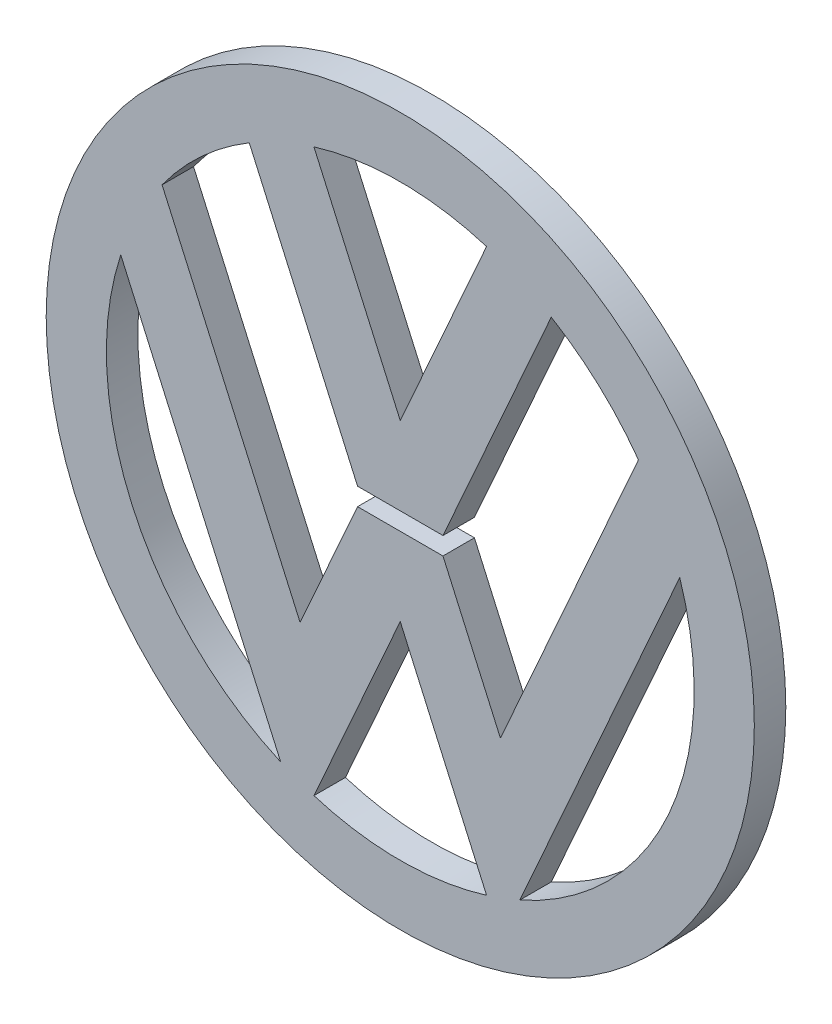
from build123d import *

# Parameters (mm, degrees)
SKETCH1_R           = 45
BOSS_EXTRUDE1_DEPTH = 4


with BuildPart() as part:
    # Sketch1 → Boss-Extrude1 (new body)
    with BuildSketch(Plane.XY):
        Circle(SKETCH1_R)
        with BuildLine():
            Line((-10.969996065, 35.702684582), (0, 11.06367001))
            Line((0, 11.06367001), (10.969996065, 35.702684582))
            ThreePointArc((10.969996065, 35.702684582), (0, 37.35), (-10.969996065, 35.702684582))
        make_face(mode=Mode.SUBTRACT)
        with BuildLine():
            Line((-10.969996065, -35.702684582), (0, -11.06367001))
            Line((0, -11.06367001), (10.969996065, -35.702684582))
            ThreePointArc((10.969996065, -35.702684582), (0, -37.35), (-10.969996065, -35.702684582))
        make_face(mode=Mode.SUBTRACT)
        with BuildLine():
            Line((-35.521960884, 11.54178474), (-15.191613619, -34.120922843))
            ThreePointArc((-15.191613619, -34.120922843), (-34.120922843, -15.191613619), (-35.521960884, 11.54178474))
        make_face(mode=Mode.SUBTRACT)
        with BuildLine():
            Line((-30.272016712, 21.877557089), (-12.728681992, -17.525417828))
            Line((-12.728681992, -17.525417828), (-5.426745524, -1.125))
            Line((-5.426745524, -1.125), (5.426745524, -1.125))
            Line((5.426745524, -1.125), (12.728681992, -17.525417828))
            Line((12.728681992, -17.525417828), (30.272016712, 21.877557089))
            ThreePointArc((30.272016712, 21.877557089), (25.248745429, 27.523142159), (19.191905184, 32.042054794))
            Line((19.191905184, 32.042054794), (5.426745524, 1.125))
            Line((5.426745524, 1.125), (-5.426745524, 1.125))
            Line((-5.426745524, 1.125), (-19.191905184, 32.042054794))
            ThreePointArc((-19.191905184, 32.042054794), (-25.248745429, 27.523142159), (-30.272016712, 21.877557089))
        make_face(mode=Mode.SUBTRACT)
        with BuildLine():
            Line((35.521960884, 11.54178474), (15.191613619, -34.120922843))
            ThreePointArc((15.191613619, -34.120922843), (34.120922843, -15.191613619), (35.521960884, 11.54178474))
        make_face(mode=Mode.SUBTRACT)
    extrude(amount=BOSS_EXTRUDE1_DEPTH)


solid = part.part
